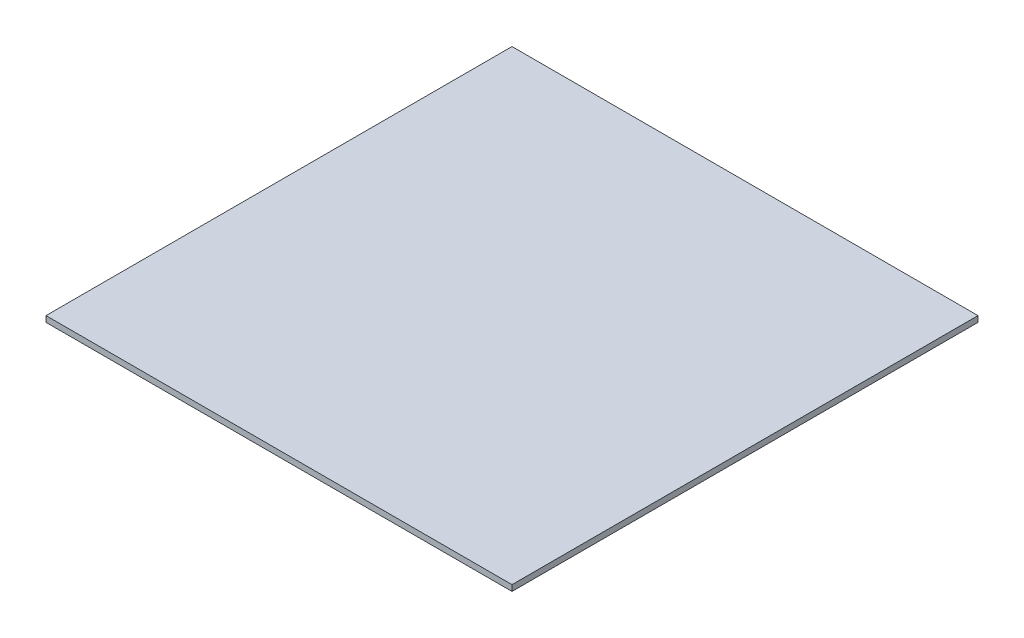
from build123d import *

# Parameters (mm, degrees)
SKETCH1_W           = 473
SKETCH1_H           = 473
BOSS_EXTRUDE1_DEPTH = 6


with BuildPart() as part:
    # Sketch1 → Boss-Extrude1 (new body)
    with BuildSketch(Plane(origin=(0, 0, 0), x_dir=(1, 0, 0), z_dir=(0, 1, 0))):
        with Locations((-236.5, 236.5)):
            Rectangle(SKETCH1_W, SKETCH1_H)
    extrude(amount=BOSS_EXTRUDE1_DEPTH)


solid = part.part
